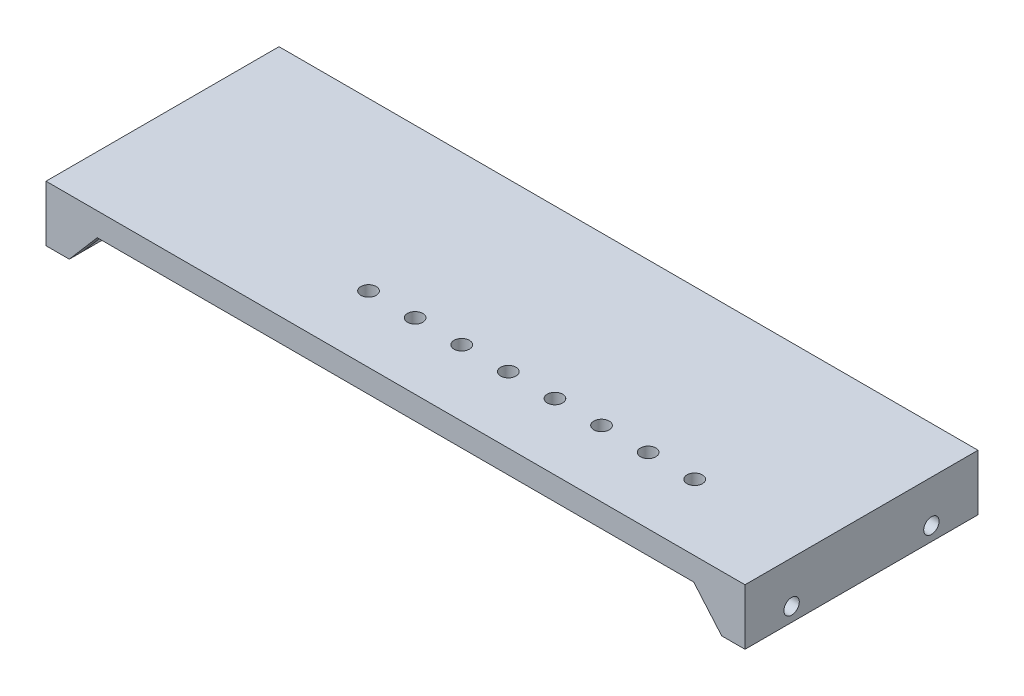
from build123d import *

# Parameters (mm, degrees)
EXTRUDE_2_DEPTH          = 50
CUT_EXTRUDE_1_DEPTH      = 154.847326919
CUT_EXTRUDE_1_DEPTH_BACK = 154.847326919
SKETCH_3_R               = 1.65
EXTRUDE_3_DEPTH          = 3
MIRROR_2_COPY_1_DEPTH    = 3
SKETCH_7_R               = 1.65
CUT_EXTRUDE_2_DEPTH      = 10


with BuildPart() as part:
    # 草图1 → 凸台-拉伸2 (new body)
    with BuildSketch(Plane.XY):
        Polygon((-75, 0), (75, 0), (75, -12), (70, -12), (70, -5), (-70, -5), (-70, -12), (-75, -12), align=None)
    extrude(amount=EXTRUDE_2_DEPTH)

    # 草图3 → 切除-拉伸1 (cut, two sides: drawn at the far end of the back side and taken through both)
    with BuildSketch(Plane(origin=(-70, 0, 0), x_dir=(0, 0, -1), z_dir=(1, 0, 0)).offset(-CUT_EXTRUDE_1_DEPTH_BACK)):
        with Locations(Location((-10, -9, 0), (0, 0, 90))):
            Circle(SKETCH_3_R)
        with Locations(Location((-40, -9, 0), (0, 0, 90))):
            Circle(SKETCH_3_R)
    extrude(amount=CUT_EXTRUDE_1_DEPTH + CUT_EXTRUDE_1_DEPTH_BACK, mode=Mode.SUBTRACT)

    # 草图4 → 凸台-拉伸3 (add)
    with BuildSketch(Plane(origin=(0, 0, 0), x_dir=(-1, 0, 0), z_dir=(0, 0, -1))):
        Polygon((64, -5), (70, -12), (70, -5), align=None)
    extrude_3 = extrude(amount=-EXTRUDE_3_DEPTH)

    # 镜向1: 凸台-拉伸3 across plane
    add(extrude_3.mirror(Plane.XY.offset(25)))

    # 镜向2: 凸台-拉伸3 across plane
    add(extrude_3.mirror(Plane(origin=(0, 0, 0), x_dir=(0, 0, 1), z_dir=(1, 0, 0))))

    # 镜向2 copy 1 sketch → 镜向2 copy 1 (add)
    with BuildSketch(Plane.XY.offset(50)):
        Polygon((64, -5), (70, -12), (70, -5), align=None)
    extrude(amount=-MIRROR_2_COPY_1_DEPTH)

    # 草图7 → 切除-拉伸2 (cut)
    with BuildSketch(Plane(origin=(0, 0, 0), x_dir=(1, 0, 0), z_dir=(0, 1, 0))):
        with Locations(Location((50, -35.79, 0), (0, 0, 270))):
            Circle(SKETCH_7_R)
        with Locations(Location((40, -35.79, 0), (0, 0, 270))):
            Circle(SKETCH_7_R)
        with Locations(Location((30, -35.79, 0), (0, 0, 270))):
            Circle(SKETCH_7_R)
        with Locations(Location((20, -35.79, 0), (0, 0, 270))):
            Circle(SKETCH_7_R)
        with Locations(Location((10, -35.79, 0), (0, 0, 270))):
            Circle(SKETCH_7_R)
        with Locations(Location((0, -35.79, 0), (0, 0, 270))):
            Circle(SKETCH_7_R)
        with Locations(Location((-10, -35.79, 0), (0, 0, 270))):
            Circle(SKETCH_7_R)
        with Locations(Location((-20, -35.79, 0), (0, 0, 270))):
            Circle(SKETCH_7_R)
    extrude(amount=-CUT_EXTRUDE_2_DEPTH, mode=Mode.SUBTRACT)


solid = part.part
